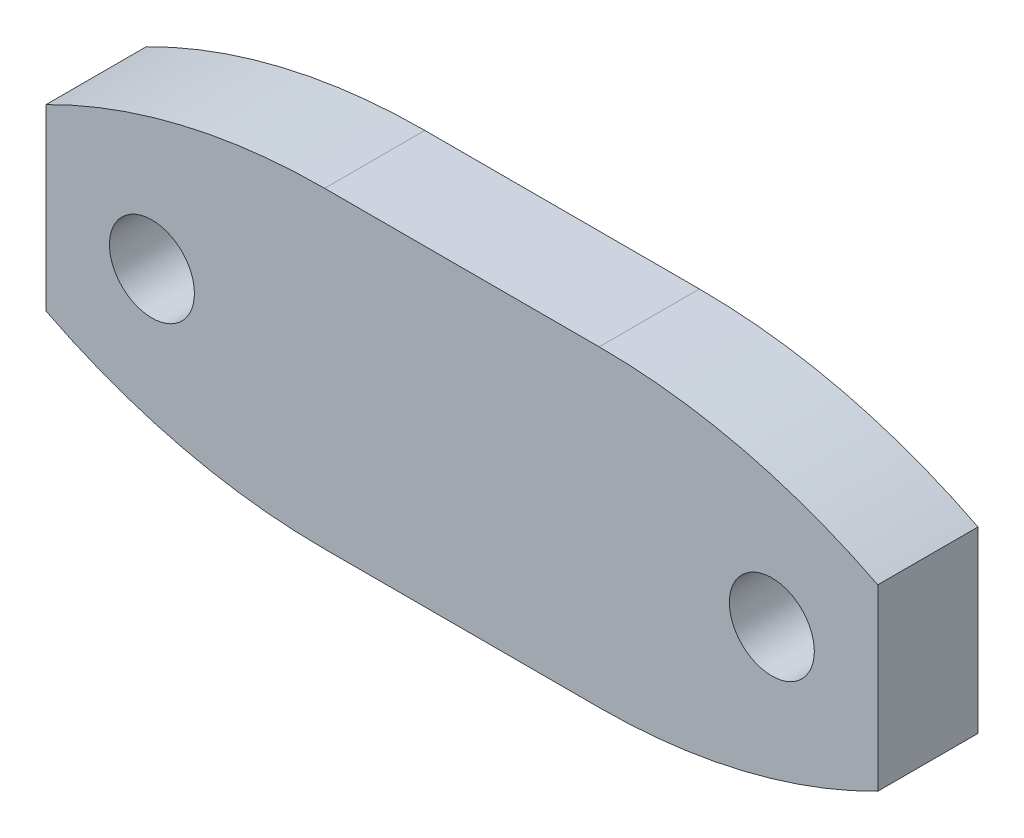
from build123d import *

# Parameters (mm, degrees)
SKETCH1_W                = 63.9
SKETCH1_H                = 24
BOSS_EXTRUDE1_DEPTH      = 7.7
F_5_16_18_TAPPED_HOLE1_D = 6.5278
CUT_EXTRUDE1_DEPTH       = 69.69133861


with BuildPart() as part:
    # Sketch1 → Boss-Extrude1 (new body)
    with BuildSketch(Plane.XY):
        with Locations((31.95, 12)):
            Rectangle(SKETCH1_W, SKETCH1_H)
    extrude(amount=BOSS_EXTRUDE1_DEPTH)

    # 5/16-18 Tapped Hole1 (through all)
    with Locations(Plane(origin=(8.1375, 12, 7.7), x_dir=(1, 0, 0), z_dir=(0, 0, 1))):
        with Locations((0, 0), (47.625, 0)):
            Hole(F_5_16_18_TAPPED_HOLE1_D / 2)

    # Sketch4 → Cut-Extrude1 (cut, through all)
    with BuildSketch(Plane.XY.offset(7.7)):
        with BuildLine():
            ThreePointArc((0, 18.867585454), (10.39806648, 22.698962504), (21.402908053, 24))
            Line((21.402908053, 24), (0, 24))
            Line((0, 24), (0, 18.867585454))
        make_face()
        with BuildLine():
            Line((0, 0), (21.402908053, 0))
            ThreePointArc((21.402908053, 0), (10.39806648, 1.301037496), (0, 5.132414546))
            Line((0, 5.132414546), (0, 0))
        make_face()
        with BuildLine():
            Line((63.9, 0), (63.9, 5.132414546))
            ThreePointArc((63.9, 5.132414546), (53.50193352, 1.301037496), (42.497091947, 0))
            Line((42.497091947, 0), (63.9, 0))
        make_face()
        with BuildLine():
            Line((63.9, 18.867585454), (63.9, 24))
            Line((63.9, 24), (42.497091947, 24))
            ThreePointArc((42.497091947, 24), (53.50193352, 22.698962504), (63.9, 18.867585454))
        make_face()
    extrude(amount=-CUT_EXTRUDE1_DEPTH, mode=Mode.SUBTRACT)


solid = part.part
